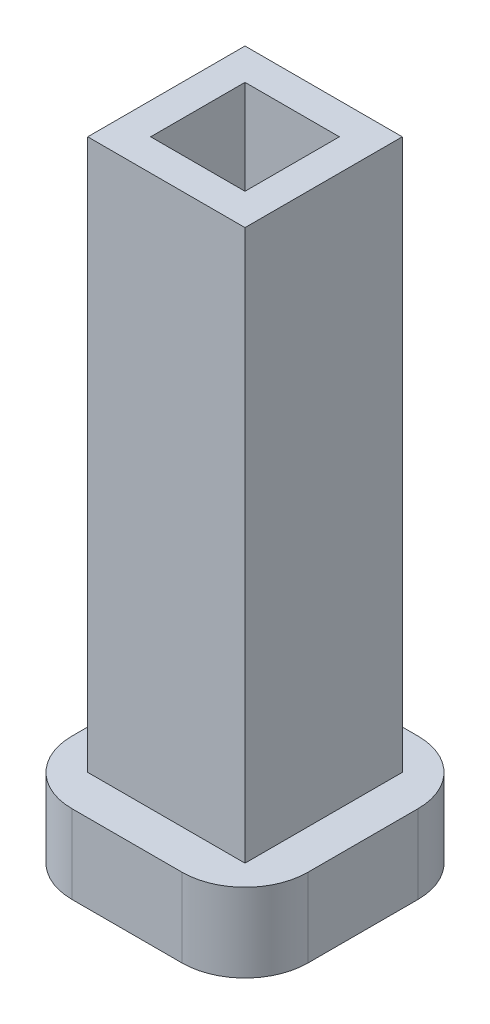
from build123d import *

# Parameters (mm, degrees)
ESBO_O2_W                = 15
ESBO_O2_H                = 15
RESSALTO_EXTRUS_O2_DEPTH = 5
ESBO_O3_W                = 10
ESBO_O3_H                = 10
RESSALTO_EXTRUS_O3_DEPTH = 35
FILETE1_R                = 4
ESBO_O4_W                = 6
ESBO_O4_H                = 6
CORTE_EXTRUS_O1_DEPTH    = 46.276925691


with BuildPart() as part:
    # Esboço2 → Ressalto-extrusão2 (new body)
    with BuildSketch(Plane(origin=(0, 0, 0), x_dir=(1, 0, 0), z_dir=(0, 1, 0))):
        with Locations((7.5, -7.5)):
            Rectangle(ESBO_O2_W, ESBO_O2_H)
    extrude(amount=RESSALTO_EXTRUS_O2_DEPTH)

    # Esboço3 → Ressalto-extrusão3 (add)
    with BuildSketch(Plane(origin=(0, 5, 0), x_dir=(1, 0, 0), z_dir=(0, 1, 0))):
        with Locations((7.5, -7.5)):
            Rectangle(ESBO_O3_W, ESBO_O3_H)
    extrude(amount=RESSALTO_EXTRUS_O3_DEPTH)

    # Filete1
    filete1_edges = [part.edges().sort_by_distance(p)[0] for p in [
        (0, 2.5, 0),
        (15, 2.5, 0),
        (15, 2.5, 15),
        (0, 2.5, 15),
    ]]
    fillet(filete1_edges, radius=FILETE1_R)

    # Esboço4 → Corte-extrusão1 (cut, through all)
    with BuildSketch(Plane(origin=(0, 40, 0), x_dir=(1, 0, 0), z_dir=(0, 1, 0))):
        with Locations((7.5, -7.5)):
            Rectangle(ESBO_O4_W, ESBO_O4_H)
    extrude(amount=-CORTE_EXTRUS_O1_DEPTH, mode=Mode.SUBTRACT)


solid = part.part
